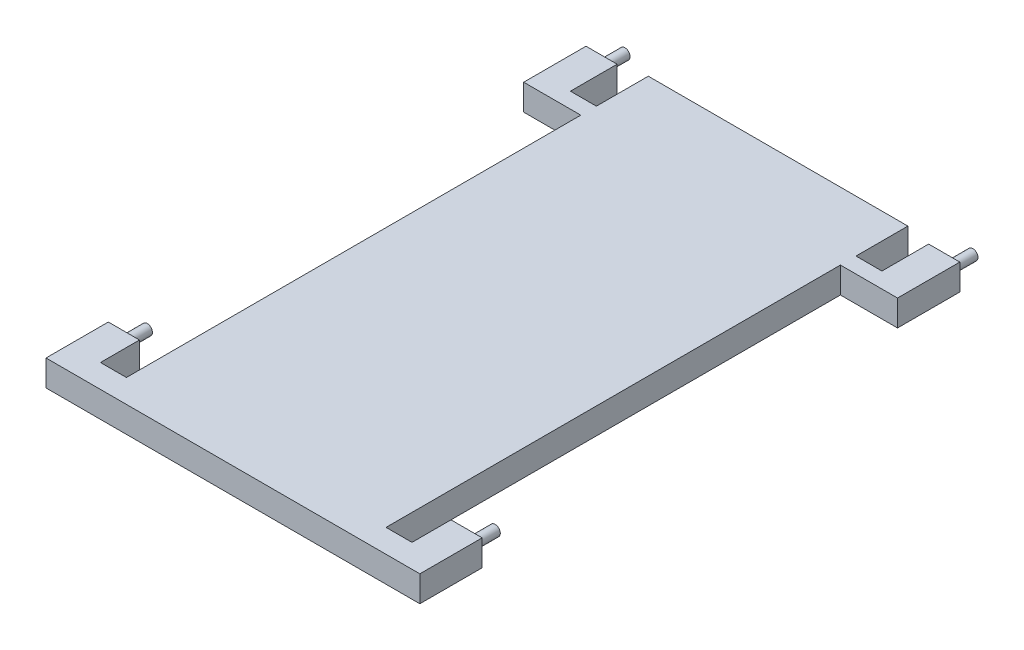
from build123d import *

# Parameters (mm, degrees)
BOSS_EXTRUDE1_DEPTH = 50
SKETCH2_R           = 10
BOSS_EXTRUDE2_DEPTH = 50
SKETCH3_R           = 10
BOSS_EXTRUDE3_DEPTH = 50
SKETCH4_R           = 10
BOSS_EXTRUDE4_DEPTH = 50
SKETCH5_R           = 10
BOSS_EXTRUDE5_DEPTH = 50


with BuildPart() as part:
    # Sketch1 → Boss-Extrude1 (new body)
    with BuildSketch(Plane(origin=(0, 0, 0), x_dir=(1, 0, 0), z_dir=(0, 1, 0))):
        Polygon((1413.835542094, 637.601174935), (1413.835542094, 537.601174935), (1463.835542094, 537.601174935), (1463.835542094, 627.601174935), (1523.835542094, 627.601174935), (1523.835542094, 507.601174935), (1413.835542094, 507.601174935), (1413.835542094, -367.509476585), (1463.835542094, -367.509476585), (1463.835542094, -292.398825065), (1523.835542094, -292.398825065), (1523.835542094, -412.398825065), (1413.835542094, -412.398825065), (913.835542094, -412.398825065), (803.835542094, -412.398825065), (803.835542094, -292.398825065), (863.835542094, -292.398825065), (863.835542094, -367.509476585), (913.835542094, -367.509476585), (913.835542094, 507.601174935), (803.835542094, 507.601174935), (803.835542094, 627.601174935), (863.835542094, 627.601174935), (863.835542094, 537.601174935), (913.835542094, 537.601174935), (913.835542094, 637.601174935), align=None)
    extrude(amount=BOSS_EXTRUDE1_DEPTH)

    # Sketch2 → Boss-Extrude2 (add)
    with BuildSketch(Plane(origin=(0, 0, -627.601174935), x_dir=(-1, 0, 0), z_dir=(0, 0, -1))):
        with Locations(Location((-828.835542094, 25, 0), (0, 0, 180))):
            Circle(SKETCH2_R)
    extrude(amount=BOSS_EXTRUDE2_DEPTH)

    # Sketch3 → Boss-Extrude3 (add)
    with BuildSketch(Plane(origin=(0, 0, 292.398825065), x_dir=(-1, 0, 0), z_dir=(0, 0, -1))):
        with Locations(Location((-828.835542094, 25, 0), (0, 0, 180))):
            Circle(SKETCH3_R)
    extrude(amount=BOSS_EXTRUDE3_DEPTH)

    # Sketch4 → Boss-Extrude4 (add)
    with BuildSketch(Plane(origin=(0, 0, -627.601174935), x_dir=(-1, 0, 0), z_dir=(0, 0, -1))):
        with Locations(Location((-1498.835542094, 25, 0), (0, 0, 180))):
            Circle(SKETCH4_R)
    extrude(amount=BOSS_EXTRUDE4_DEPTH)

    # Sketch5 → Boss-Extrude5 (add)
    with BuildSketch(Plane(origin=(0, 0, 292.398825065), x_dir=(-1, 0, 0), z_dir=(0, 0, -1))):
        with Locations(Location((-1498.835542094, 25, 0), (0, 0, 180))):
            Circle(SKETCH5_R)
    extrude(amount=BOSS_EXTRUDE5_DEPTH)


solid = part.part
